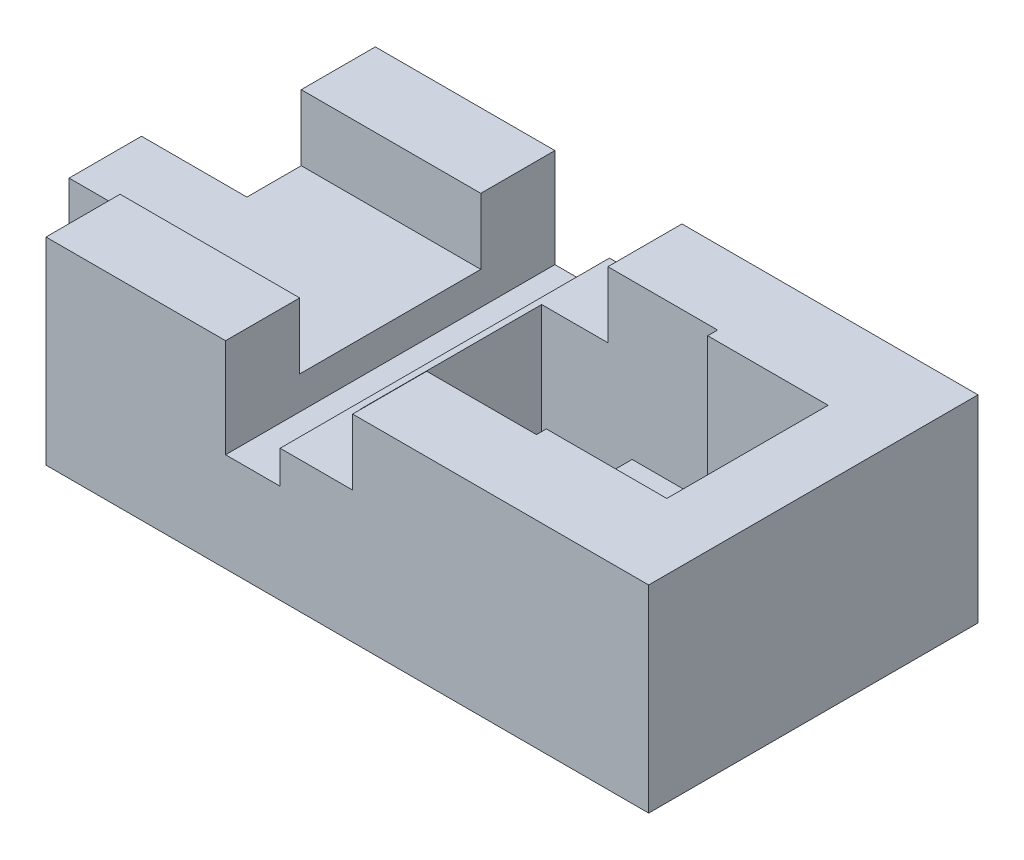
from build123d import *

# Parameters (mm, degrees)
SKETCH1_W               = 19.5
SKETCH1_H               = 10
BOSS_EXTRUDE1_DEPTH     = 4
SKETCH2_W               = 9
SKETCH2_H               = 5.5
CUT_EXTRUDE1_DEPTH      = 2.7
SKETCH3_W               = 3.2
SKETCH3_H               = 3.9
CUT_EXTRUDE2_DEPTH      = 12.664583147
SKETCH4_W               = 1.747901038
SKETCH4_H               = 5.5
CUT_EXTRUDE3_DEPTH      = 12.285056491
CHAMFER2_SIZE           = 1
SKETCH5_W               = 10
SKETCH5_H               = 4
BOSS_EXTRUDE2_DEPTH     = 2
SKETCH6_W               = 1.747077863
SKETCH6_H               = 5.5
BOSS_EXTRUDE3_DEPTH     = 1.5
BOSS_EXTRUDE4_DEPTH     = 2
BOSS_EXTRUDE5_REACH     = 16.109
SKETCH9_W               = 3.657403566
SKETCH9_H               = 0.3
SKETCH10_W              = 5.81497097
SKETCH10_H              = 2.25
SKETCH10_W_2            = 5.452409629
BOSS_EXTRUDE6_DEPTH     = 2
CUT_EXTRUDE4_DEPTH      = 3.8
CUT_EXTRUDE4_DEPTH_BACK = 1
SKETCH12_W              = 1.656525066
SKETCH12_H              = 10


with BuildPart() as part:
    # Sketch1 → Boss-Extrude1 (new body)
    with BuildSketch(Plane(origin=(0, 0, 0), x_dir=(1, 0, 0), z_dir=(0, 1, 0))):
        Rectangle(SKETCH1_W, SKETCH1_H)
    extrude(amount=BOSS_EXTRUDE1_DEPTH)

    # Sketch2 → Cut-Extrude1 (cut)
    with BuildSketch(Plane(origin=(0, 4, 0), x_dir=(1, 0, 0), z_dir=(0, 1, 0))):
        with Locations((5.25, 0)):
            Rectangle(SKETCH2_W, SKETCH2_H)
    extrude(amount=-CUT_EXTRUDE1_DEPTH, mode=Mode.SUBTRACT)

    # Sketch3 → Cut-Extrude2 (cut, through all)
    with BuildSketch(Plane(origin=(0, 4, 0), x_dir=(1, 0, 0), z_dir=(0, 1, 0))):
        with Locations((-8.15, 3.05)):
            Rectangle(SKETCH3_W, SKETCH3_H)
        with Locations((-8.15, -3.05)):
            Rectangle(SKETCH3_W, SKETCH3_H)
    extrude(amount=-CUT_EXTRUDE2_DEPTH, mode=Mode.SUBTRACT)

    # Sketch4 → Cut-Extrude3 (cut, through all)
    with BuildSketch(Plane(origin=(0, 1.3, 0), x_dir=(1, 0, 0), z_dir=(0, 1, 0))):
        with Locations((1.623950519, 0)):
            Rectangle(SKETCH4_W, SKETCH4_H)
    extrude(amount=-CUT_EXTRUDE3_DEPTH, mode=Mode.SUBTRACT)

    # Chamfer2
    chamfer2_edges = [part.edges().sort_by_distance(p)[0] for p in [
        (2.497901038, 1.3, 0),
    ]]
    chamfer(chamfer2_edges, length=CHAMFER2_SIZE)

    # Sketch5 → Boss-Extrude2 (add)
    with BuildSketch(Plane(origin=(9.75, 0, 0), x_dir=(0, 0, -1), z_dir=(1, 0, 0))):
        with Locations((0, 2)):
            Rectangle(SKETCH5_W, SKETCH5_H)
    extrude(amount=BOSS_EXTRUDE2_DEPTH)

    # Sketch6 → Boss-Extrude3 (add)
    with BuildSketch(Plane(origin=(0, 1.3, 0), x_dir=(1, 0, 0), z_dir=(0, 1, 0))):
        with Locations((8.876461068, 0)):
            Rectangle(SKETCH6_W, SKETCH6_H)
    extrude(amount=BOSS_EXTRUDE3_DEPTH)

    # Sketch7 → Boss-Extrude4 (add)
    with BuildSketch(Plane(origin=(0, 4, 0), x_dir=(1, 0, 0), z_dir=(0, 1, 0))):
        Polygon((2.760699465, 2.75), (2.760699465, 5), (11.75, 5), (11.75, -5), (2.760699465, -5), (2.760699465, -2.75), (9.75, -2.75), (9.75, 2.75), align=None)
    extrude(amount=BOSS_EXTRUDE4_DEPTH)

    # Sketch9 → Boss-Extrude5 (add, up to next)
    with BuildSketch(Plane(origin=(0, 6, 0), x_dir=(1, 0, 0), z_dir=(0, 1, 0)), mode=Mode.PRIVATE) as boss_extrude5_sk1:
        with Locations((7.921298217, 2.6)):
            Rectangle(SKETCH9_W, SKETCH9_H)
    boss_extrude5_tool1 = extrude(boss_extrude5_sk1.sketch, amount=-BOSS_EXTRUDE5_REACH, mode=Mode.PRIVATE) - part.part
    # Sketch9 → Boss-Extrude5 (add, up to next)
    with BuildSketch(Plane(origin=(0, 6, 0), x_dir=(1, 0, 0), z_dir=(0, 1, 0)), mode=Mode.PRIVATE) as boss_extrude5_sk2:
        with Locations((7.921298217, -2.6)):
            Rectangle(SKETCH9_W, SKETCH9_H)
    boss_extrude5_tool2 = extrude(boss_extrude5_sk2.sketch, amount=-BOSS_EXTRUDE5_REACH, mode=Mode.PRIVATE) - part.part
    add(boss_extrude5_tool1.solids().sort_by_distance((7.921298, 6, -2.6))[0])
    add(boss_extrude5_tool2.solids().sort_by_distance((7.921298, 6, 2.6))[0])

    # Sketch10 → Boss-Extrude6 (add)
    with BuildSketch(Plane(origin=(0, 4, 0), x_dir=(1, 0, 0), z_dir=(0, 1, 0))):
        with Locations((-3.642514515, 3.875)):
            Rectangle(SKETCH10_W, SKETCH10_H)
        with Locations((-3.823795186, -3.875)):
            Rectangle(SKETCH10_W_2, SKETCH10_H)
    extrude(amount=BOSS_EXTRUDE6_DEPTH)

    # Sketch12 → Cut-Extrude4 (cut, two sides: drawn at the far end of the back side and taken through both)
    with BuildSketch(Plane(origin=(0, 4, 0), x_dir=(1, 0, 0), z_dir=(0, 1, 0)).offset(-CUT_EXTRUDE4_DEPTH_BACK)):
        with Locations((-0.269327838, 0)):
            Rectangle(SKETCH12_W, SKETCH12_H)
    extrude(amount=CUT_EXTRUDE4_DEPTH + CUT_EXTRUDE4_DEPTH_BACK, mode=Mode.SUBTRACT)


solid = part.part
